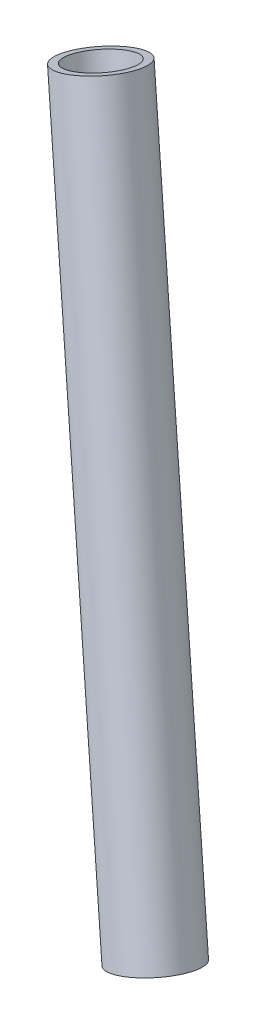
from build123d import *

# Parameters (mm, degrees)
SKETCH1_R               = 16.7005
SKETCH1_R_2             = 13.3223
PIPE_1_0_SCH_40_1_DEPTH = 294.022965518


with BuildPart() as part:
    # Sketch1 → Pipe 1.0 SCH 40(1) (new body)
    with BuildSketch(Plane(origin=(3261.981257901, 580.503406559, 450.845329314), x_dir=(0.9373296965246388, 0.21623009322286818, -0.27323540546177083), z_dir=(0.27323540546177083, -0.9427386484256428, 0.1912753354897966))):
        Circle(SKETCH1_R)
        Circle(SKETCH1_R_2, mode=Mode.SUBTRACT)
    extrude(amount=PIPE_1_0_SCH_40_1_DEPTH)


solid = part.part
